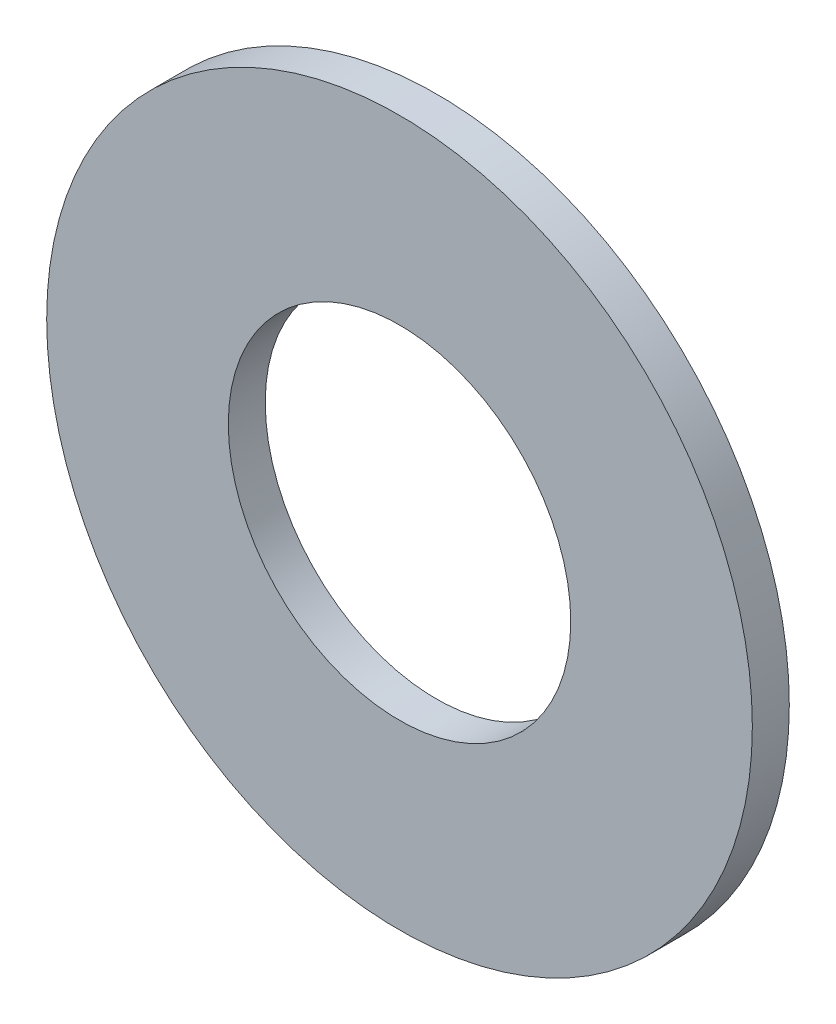
from build123d import *

# Parameters (mm, degrees)
SKETCH1_R           = 34
SKETCH1_R_2         = 16.5
BOSS_EXTRUDE1_DEPTH = 3.562


with BuildPart() as part:
    # Sketch1 → Boss-Extrude1 (new body)
    with BuildSketch(Plane.XY):
        Circle(SKETCH1_R)
        Circle(SKETCH1_R_2, mode=Mode.SUBTRACT)
    extrude(amount=BOSS_EXTRUDE1_DEPTH)


solid = part.part
